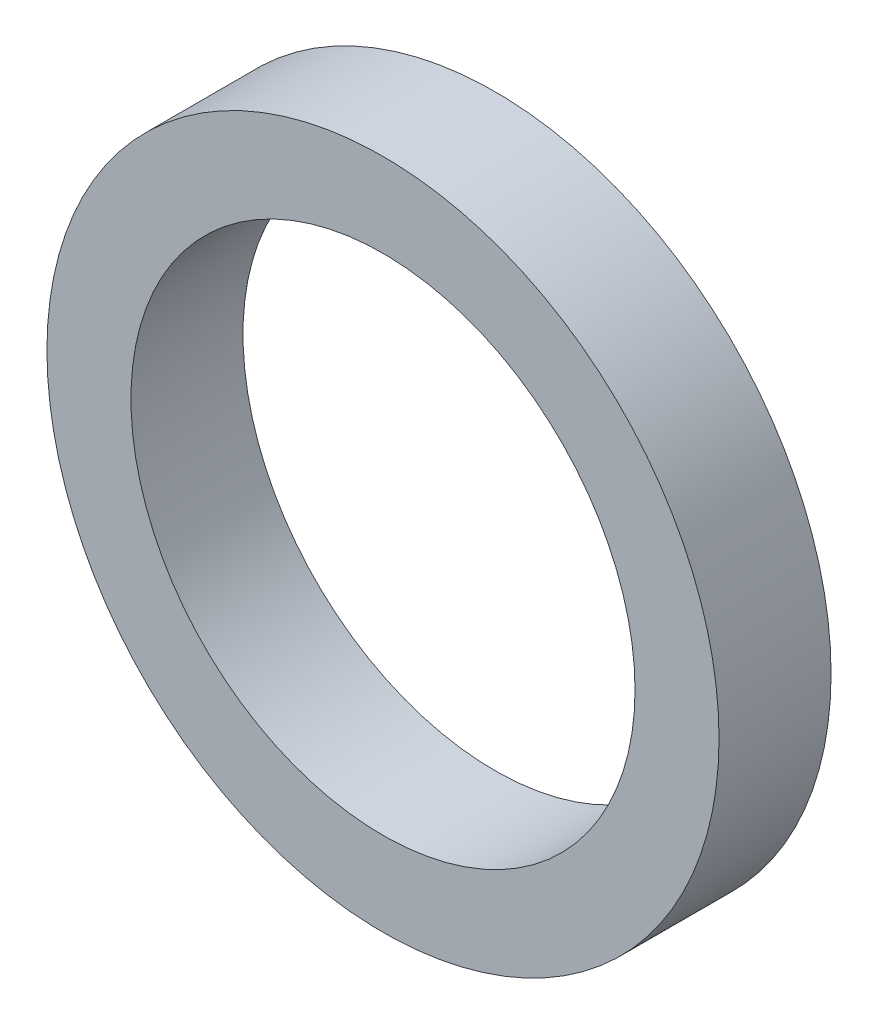
from build123d import *

# Parameters (mm, degrees)
SKETCH_1_R      = 30
SKETCH_1_R_2    = 22.5
EXTRUDE_1_DEPTH = 10


with BuildPart() as part:
    # 草图1 → 凸台-拉伸1 (new body)
    with BuildSketch(Plane.XY):
        Circle(SKETCH_1_R)
        Circle(SKETCH_1_R_2, mode=Mode.SUBTRACT)
    extrude(amount=EXTRUDE_1_DEPTH)


solid = part.part
